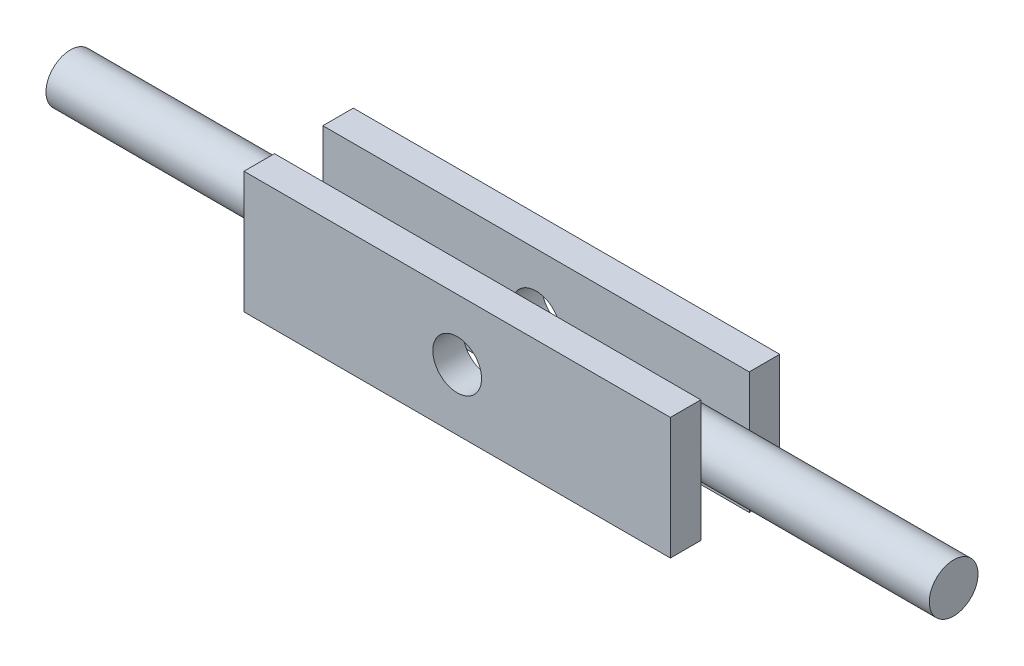
from build123d import *

# Parameters (mm, degrees)
SKETCH1_W                = 140
SKETCH1_H                = 40
BOSS_EXTRUDE1_DEPTH      = 10
SKETCH4_R                = 8
CUT_EXTRUDE1_DEPTH       = 10
BOSS_EXTRUDE2_DEPTH      = 75
BOSS_EXTRUDE2_DEPTH_BACK = 20
SKETCH5_R                = 8
LPATTERN1_COUNT          = 2
LPATTERN1_PITCH          = 25.9
CUT_EXTRUDE2_START       = -100
SKETCH6_R                = 8
CUT_EXTRUDE2_DEPTH       = 100
BOSS_EXTRUDE3_DEPTH      = 75
BOSS_EXTRUDE3_DEPTH_BACK = 20
SKETCH7_R                = 8


with BuildPart() as part:
    # Sketch1 → Boss-Extrude1 (new body)
    with BuildSketch(Plane.XY):
        Rectangle(SKETCH1_W, SKETCH1_H)
    boss_extrude1 = extrude(amount=BOSS_EXTRUDE1_DEPTH)

    # Sketch4 → Cut-Extrude1 (cut)
    with BuildSketch(Plane.XY.offset(10)):
        Circle(SKETCH4_R)
    extrude(amount=-CUT_EXTRUDE1_DEPTH, mode=Mode.SUBTRACT)


with BuildPart() as body_2:
    # Sketch5 → Boss-Extrude2 (new, two sides: drawn at the far end of the back side and taken through both)
    with BuildSketch(Plane(origin=(70, 0, 0), x_dir=(0, 0, -1), z_dir=(1, 0, 0)).offset(-BOSS_EXTRUDE2_DEPTH_BACK)):
        with Locations((8, 0)):
            Circle(SKETCH5_R)
    extrude(amount=BOSS_EXTRUDE2_DEPTH + BOSS_EXTRUDE2_DEPTH_BACK)

    # LPattern1: Boss-Extrude1 ×2
    with Locations(*[(0, 0, -i * LPATTERN1_PITCH) for i in range(1, LPATTERN1_COUNT)]):
        add(boss_extrude1)

    # Sketch6 → Cut-Extrude2 (cut)
    with BuildSketch(Plane(origin=(0, 0, -25.9), x_dir=(-1, 0, 0), z_dir=(0, 0, -1)).offset(CUT_EXTRUDE2_START)):
        Circle(SKETCH6_R)
    extrude(amount=CUT_EXTRUDE2_DEPTH, mode=Mode.SUBTRACT)


with BuildPart() as body_3:
    # Sketch7 → Boss-Extrude3 (new, two sides: drawn at the far end of the back side and taken through both)
    with BuildSketch(Plane.ZY.offset(70).offset(-BOSS_EXTRUDE3_DEPTH_BACK)):
        with Locations((-8, 0)):
            Circle(SKETCH7_R)
    extrude(amount=BOSS_EXTRUDE3_DEPTH + BOSS_EXTRUDE3_DEPTH_BACK)


solid = Compound([part.part, body_2.part, body_3.part])
